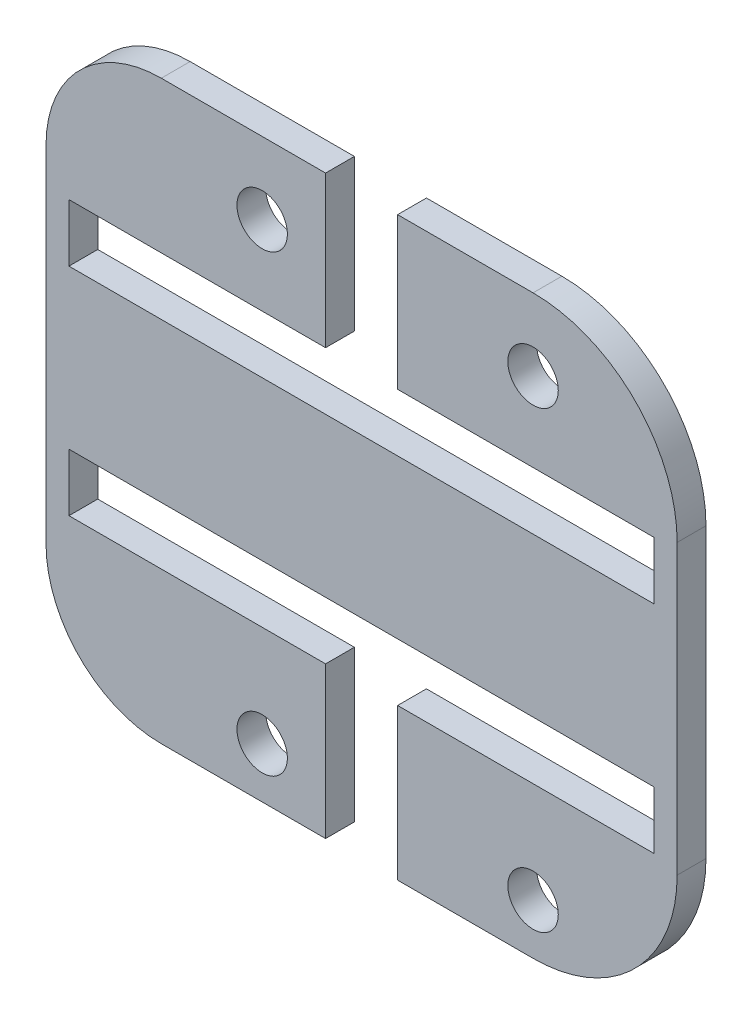
from build123d import *

# Parameters (mm, degrees)
SALIENTE_EXTRUIR1_DEPTH = 2
CROQUIS4_R              = 1.75
CORTAR_EXTRUIR1_DEPTH   = 2
REDONDEO1_R             = 10
REDONDEO2_R             = 8


with BuildPart() as part:
    # Croquis2 → Saliente-Extruir1 (new body)
    with BuildSketch(Plane.XY):
        Polygon((0, 40), (0, 0), (19.4, 0), (19.4, 10.5), (1.59, 10.5), (1.59, 14.5), (42.21, 14.5), (42.21, 10.5), (24.4, 10.5), (24.4, 0), (43.8, 0), (43.8, 40), (24.4, 40), (24.4, 29.5), (42.21, 29.5), (42.21, 25.5), (1.59, 25.5), (1.59, 29.5), (19.4, 29.5), (19.4, 40), align=None)
    extrude(amount=SALIENTE_EXTRUIR1_DEPTH)

    # Croquis4 → Cortar-Extruir1 (cut)
    with BuildSketch(Plane.XY.offset(2)):
        with Locations((15, 35)):
            Circle(CROQUIS4_R)
        with Locations((15, 3.5)):
            Circle(CROQUIS4_R)
        with Locations((33.8, 35)):
            Circle(CROQUIS4_R)
        with Locations((33.8, 3.5)):
            Circle(CROQUIS4_R)
    extrude(amount=-CORTAR_EXTRUIR1_DEPTH, mode=Mode.SUBTRACT)

    # Redondeo1
    redondeo1_edges = [part.edges().sort_by_distance(p)[0] for p in [
        (43.8, 40, 1),
        (43.8, 0, 1),
    ]]
    fillet(redondeo1_edges, radius=REDONDEO1_R)

    # Redondeo2
    redondeo2_edges = [part.edges().sort_by_distance(p)[0] for p in [
        (0, 0, 1),
        (0, 40, 1),
    ]]
    fillet(redondeo2_edges, radius=REDONDEO2_R)


solid = part.part
